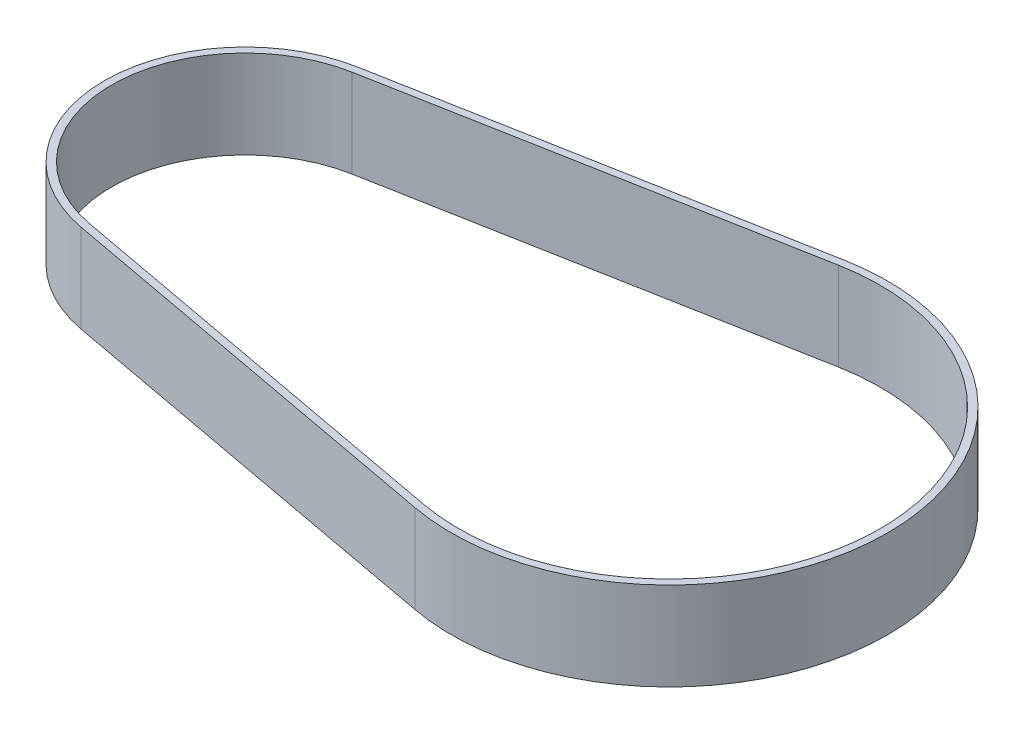
from build123d import *

# Parameters (mm, degrees)
EXTRU_MINCE1_DEPTH = 6


with BuildPart() as part:
    # Esquisse1 → Extru.-Mince1 (new body)
    with BuildSketch(Plane(origin=(0, 0, 0), x_dir=(1, 0, 0), z_dir=(0, 1, 0))):
        with BuildLine():
            Line((26.129305397, -14.576668847), (-1.744290554, -9.409694494))
            ThreePointArc((-1.744290554, -9.409694494), (-9.57, 0), (-1.744290554, 9.409694494))
            Line((-1.744290554, 9.409694494), (26.129305397, 14.576668847))
            ThreePointArc((26.129305397, 14.576668847), (43.65640649, 0), (26.129305397, -14.576668847))
        make_face()
        with BuildLine():
            Line((26.220438654, -14.085044266), (-1.653157296, -8.918069912))
            ThreePointArc((-1.653157296, -8.918069912), (-9.07, 0), (-1.653157296, 8.918069912))
            Line((-1.653157296, 8.918069912), (26.220438654, 14.085044266))
            ThreePointArc((26.220438654, 14.085044266), (43.15640649, 0), (26.220438654, -14.085044266))
        make_face(mode=Mode.SUBTRACT)
    extrude(amount=EXTRU_MINCE1_DEPTH)


solid = part.part
